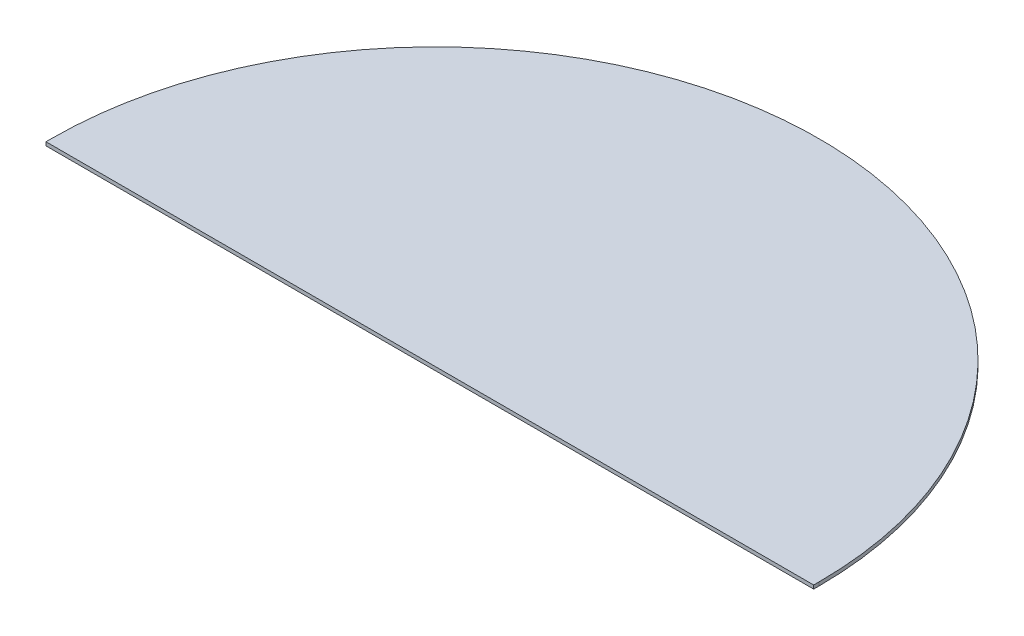
from build123d import *

# Parameters (mm, degrees)
BOSS_EXTRUDE1_DEPTH = 10


with BuildPart() as part:
    # Sketch1 → Boss-Extrude1 (new body)
    with BuildSketch(Plane(origin=(0, 0, 0), x_dir=(1, 0, 0), z_dir=(0, 1, 0))):
        with BuildLine():
            Line((0, 0), (0, -15))
            Line((0, -15), (2130, -15))
            Line((2130, -15), (2130, 0))
            ThreePointArc((2130, 0), (1065, 1065), (0, 0))
        make_face()
    extrude(amount=BOSS_EXTRUDE1_DEPTH)


solid = part.part
